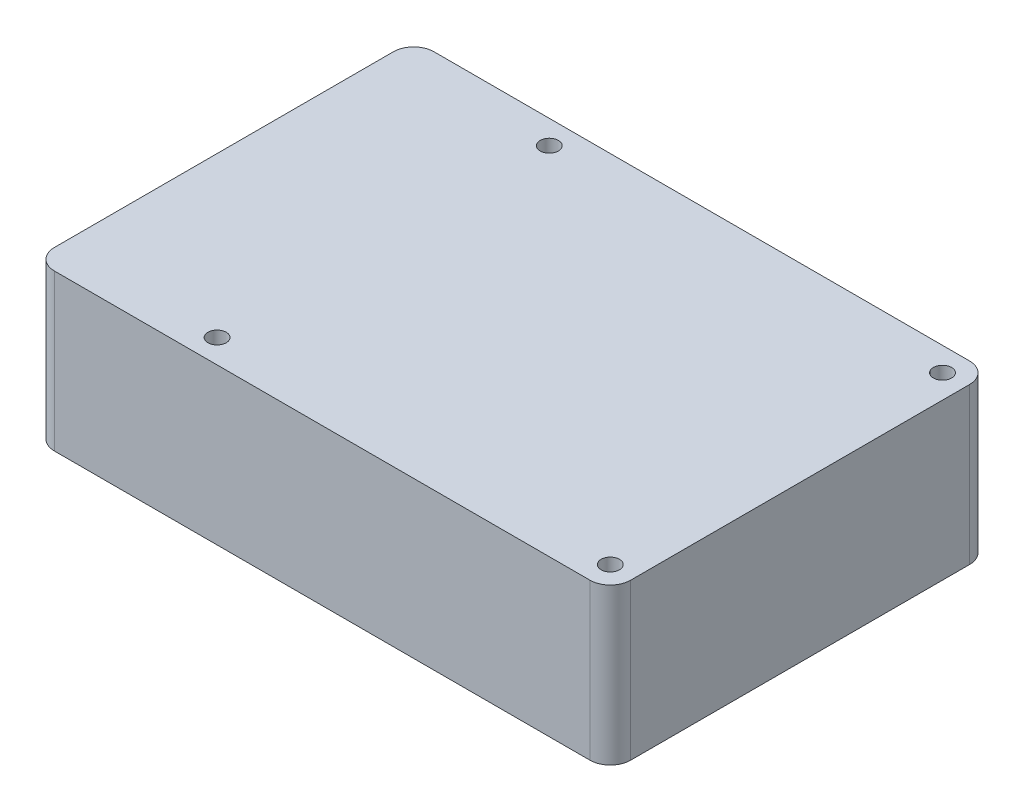
from build123d import *

# Parameters (mm, degrees)
CROQUIS1_W              = 85
CROQUIS1_H              = 56
SALIENTE_EXTRUIR1_DEPTH = 23
REDONDEO1_R             = 3
CROQUIS2_R              = 1.35
CORTAR_EXTRUIR1_DEPTH   = 56.850246195


with BuildPart() as part:
    # Croquis1 → Saliente-Extruir1 (new body)
    with BuildSketch(Plane(origin=(0, 0, 0), x_dir=(1, 0, 0), z_dir=(0, 1, 0))):
        Rectangle(CROQUIS1_W, CROQUIS1_H)
    extrude(amount=SALIENTE_EXTRUIR1_DEPTH)

    # Redondeo1
    redondeo1_edges = [part.edges().sort_by_distance(p)[0] for p in [
        (-42.5, 11.5, -28),
        (42.5, 11.5, -28),
        (42.5, 11.5, 28),
        (-42.5, 11.5, 28),
    ]]
    fillet(redondeo1_edges, radius=REDONDEO1_R)

    # Croquis2 → Cortar-Extruir1 (cut, through all)
    with BuildSketch(Plane(origin=(0, 23, 0), x_dir=(1, 0, 0), z_dir=(0, 1, 0))):
        with Locations(Location((-19, 24.5, 0), (0, 0, 270))):
            Circle(CROQUIS2_R)
        with Locations(Location((39, 24.5, 0), (0, 0, 270))):
            Circle(CROQUIS2_R)
        with Locations(Location((39, -24.5, 0), (0, 0, 270))):
            Circle(CROQUIS2_R)
        with Locations(Location((-19, -24.5, 0), (0, 0, 270))):
            Circle(CROQUIS2_R)
    extrude(amount=-CORTAR_EXTRUIR1_DEPTH, mode=Mode.SUBTRACT)


solid = part.part
